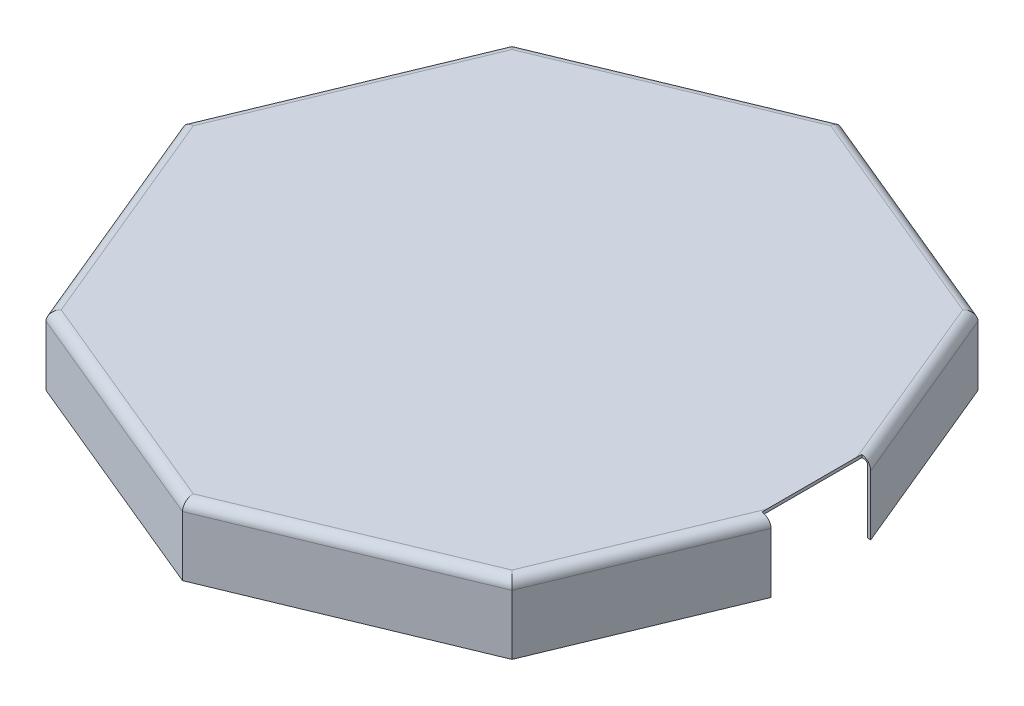
from build123d import *

# Parameters (mm, degrees)
BOSS_EXTRUDE1_DEPTH = 70
SHELL1_T            = -3
SKETCH5_W           = 100
SKETCH5_H           = 80
CUT_EXTRUDE2_DEPTH  = 30
FILLET1_R           = 10
FILLET2_R           = 3


with BuildPart() as part:
    # Sketch3 → Boss-Extrude1 (new body)
    with BuildSketch(Plane(origin=(0, 0, 0), x_dir=(1, 0, 0), z_dir=(0, 1, 0))):
        Polygon((0, 330.560430114), (-233.741521725, 233.741521725), (-330.560430114, 0), (-233.741521725, -233.741521725), (0, -330.560430114), (233.741521725, -233.741521725), (330.560430114, 0), (233.741521725, 233.741521725), align=None)
    extrude(amount=BOSS_EXTRUDE1_DEPTH)

    # Shell1
    shell1_openings = [part.faces().sort_by_distance(p)[0] for p in [
        (0, 0, 0),
    ]]
    offset(amount=SHELL1_T, openings=shell1_openings, kind=Kind.INTERSECTION)

    # Sketch5 → Cut-Extrude2 (cut)
    with BuildSketch(Plane(origin=(331, 0, 0), x_dir=(0, 0, -1), z_dir=(1, 0, 0))):
        with Locations((0, 40)):
            Rectangle(SKETCH5_W, SKETCH5_H)
    extrude(amount=-CUT_EXTRUDE2_DEPTH, mode=Mode.SUBTRACT)

    # Fillet1
    fillet1_edges = [part.edges().sort_by_distance(p)[0] for p in [
        (271.79563686, 70, 141.870760863),
        (116.870760863, 70, 282.15097592),
        (-116.870760863, 70, 282.15097592),
        (-282.15097592, 70, 116.870760863),
        (-282.15097592, 70, -116.870760863),
        (-116.870760863, 70, -282.15097592),
        (116.870760863, 70, -282.15097592),
        (271.79563686, 70, -141.870760863),
    ]]
    fillet(fillet1_edges, radius=FILLET1_R)

    # Fillet2
    fillet2_edges = [part.edges().sort_by_distance(p)[0] for p in [
        (115.722710566, 67, 279.379337322),
        (269.023998263, 67, 140.722710566),
        (115.722710566, 67, -279.379337322),
        (-115.722710566, 67, -279.379337322),
        (-279.379337322, 67, -115.722710566),
        (-279.379337322, 67, 115.722710566),
        (-115.722710566, 67, 279.379337322),
        (269.023998263, 67, -140.722710566),
    ]]
    fillet(fillet2_edges, radius=FILLET2_R)


solid = part.part
